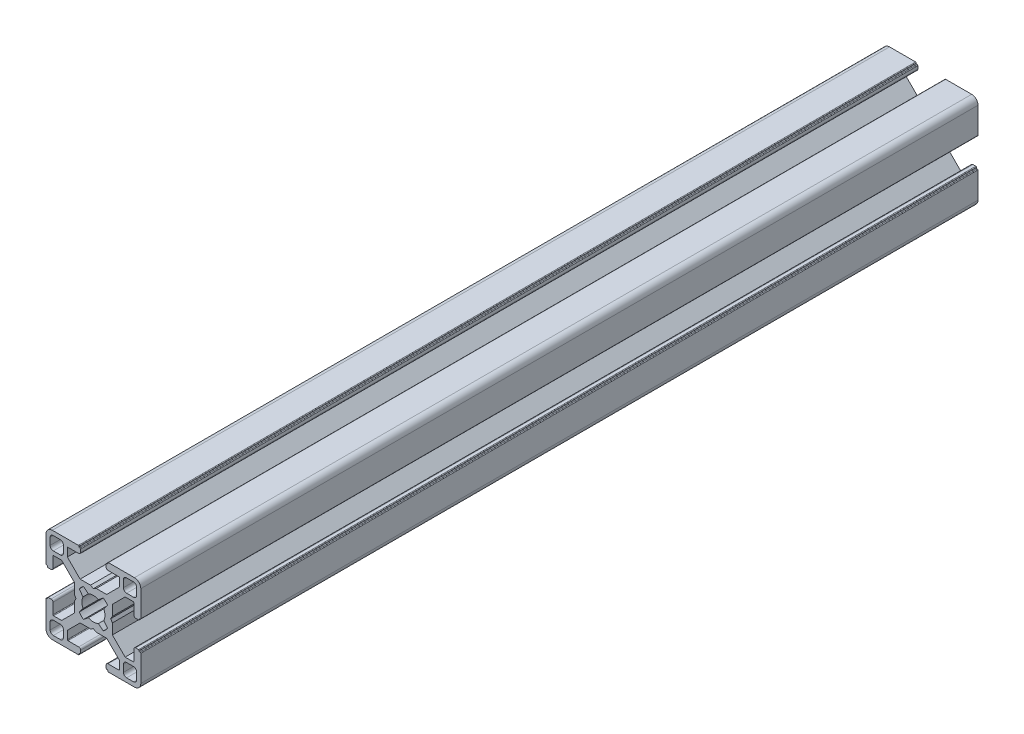
from build123d import *

# Parameters (mm, degrees)
BASE_EXTRUDE_DEPTH = 265


with BuildPart() as part:
    # Sketch1 → Base-Extrude (new body)
    with BuildSketch(Plane.XY):
        with BuildLine():
            Line((6.00446543, 0.899999619), (5.484852164, 0))
            Line((5.484852164, 0), (6.00446543, -0.899999619))
            Line((6.00446543, -0.899999619), (6.00446543, -4.204465866))
            Line((6.00446543, -4.204465866), (10.049999564, -8.25))
            Line((10.049999564, -8.25), (12.59999928, -8.25))
            ThreePointArc((12.59999928, -8.25), (12.741420837, -8.191421273), (12.799999564, -8.049999716))
            Line((12.799999564, -8.049999716), (12.799999564, -4.649999613))
            ThreePointArc((12.799999564, -4.649999613), (12.975735606, -4.225735278), (13.39999994, -4.049999237))
            Line((13.39999994, -4.049999237), (14.300000043, -4.049999237))
            ThreePointArc((14.300000043, -4.049999237), (14.4414216, -4.108577964), (14.500000327, -4.249999521))
            Line((14.500000327, -4.249999521), (14.500000327, -4.349998953))
            ThreePointArc((14.500000327, -4.349998953), (14.558579054, -4.49142051), (14.700000611, -4.549999237))
            Line((14.700000611, -4.549999237), (14.799999716, -4.549999237))
            ThreePointArc((14.799999716, -4.549999237), (14.941421273, -4.608577964), (15, -4.749999521))
            Line((15, -4.749999521), (15, -13.000000346))
            ThreePointArc((15, -13.000000346), (14.414213664, -14.414213664), (13.000000346, -15))
            Line((13.000000346, -15), (4.749999945, -15))
            ThreePointArc((4.749999945, -15), (4.60857832, -14.941421245), (4.549999564, -14.799999619))
            Line((4.549999564, -14.799999619), (4.549999564, -14.69999942))
            ThreePointArc((4.549999564, -14.69999942), (4.49142109, -14.558578474), (4.350000144, -14.5))
            Line((4.350000144, -14.5), (4.250000374, -14.5))
            ThreePointArc((4.250000374, -14.5), (4.108578753, -14.441421247), (4.05, -14.299999626))
            Line((4.05, -14.299999626), (4.05, -13.399999434))
            ThreePointArc((4.05, -13.399999434), (4.225735989, -12.975735226), (4.650000197, -12.799999237))
            Line((4.650000197, -12.799999237), (8.049999924, -12.799999237))
            ThreePointArc((8.049999924, -12.799999237), (8.191421565, -12.741420475), (8.250000327, -12.599998834))
            Line((8.250000327, -12.599998834), (8.250000327, -10.049999237))
            Line((8.250000327, -10.049999237), (4.204466193, -6))
            Line((4.204466193, -6), (0.899999946, -6))
            Line((0.899999946, -6), (0, -5.484851837))
            Line((0, -5.484851837), (-0.899999946, -6))
            Line((-0.899999946, -6), (-4.204466193, -6))
            Line((-4.204466193, -6), (-8.250000327, -10.049999237))
            Line((-8.250000327, -10.049999237), (-8.250000327, -12.599998834))
            ThreePointArc((-8.250000327, -12.599998834), (-8.191421565, -12.741420475), (-8.049999924, -12.799999237))
            Line((-8.049999924, -12.799999237), (-4.650000197, -12.799999237))
            ThreePointArc((-4.650000197, -12.799999237), (-4.225735989, -12.975735226), (-4.05, -13.399999434))
            Line((-4.05, -13.399999434), (-4.05, -14.299999626))
            ThreePointArc((-4.05, -14.299999626), (-4.108578753, -14.441421247), (-4.250000374, -14.5))
            Line((-4.250000374, -14.5), (-4.350000144, -14.5))
            ThreePointArc((-4.350000144, -14.5), (-4.49142109, -14.558578474), (-4.549999564, -14.69999942))
            Line((-4.549999564, -14.69999942), (-4.549999564, -14.799999619))
            ThreePointArc((-4.549999564, -14.799999619), (-4.60857832, -14.941421245), (-4.749999945, -15))
            Line((-4.749999945, -15), (-13.000000346, -15))
            ThreePointArc((-13.000000346, -15), (-14.414213664, -14.414213664), (-15, -13.000000346))
            Line((-15, -13.000000346), (-15, -4.749999521))
            ThreePointArc((-15, -4.749999521), (-14.941421273, -4.608577964), (-14.799999716, -4.549999237))
            Line((-14.799999716, -4.549999237), (-14.700000611, -4.549999237))
            ThreePointArc((-14.700000611, -4.549999237), (-14.558579054, -4.49142051), (-14.500000327, -4.349998953))
            Line((-14.500000327, -4.349998953), (-14.500000327, -4.249999521))
            ThreePointArc((-14.500000327, -4.249999521), (-14.4414216, -4.108577964), (-14.300000043, -4.049999237))
            Line((-14.300000043, -4.049999237), (-13.39999994, -4.049999237))
            ThreePointArc((-13.39999994, -4.049999237), (-12.975735606, -4.225735278), (-12.799999564, -4.649999613))
            Line((-12.799999564, -4.649999613), (-12.799999564, -8.049999716))
            ThreePointArc((-12.799999564, -8.049999716), (-12.741420837, -8.191421273), (-12.59999928, -8.25))
            Line((-12.59999928, -8.25), (-10.049999564, -8.25))
            Line((-10.049999564, -8.25), (-6.00446543, -4.204465866))
            Line((-6.00446543, -4.204465866), (-6.00446543, -0.899999619))
            Line((-6.00446543, -0.899999619), (-5.484852164, 0))
            Line((-5.484852164, 0), (-6.00446543, 0.899999619))
            Line((-6.00446543, 0.899999619), (-6.00446543, 4.204465866))
            Line((-6.00446543, 4.204465866), (-10.049999564, 8.25))
            Line((-10.049999564, 8.25), (-12.59999928, 8.25))
            ThreePointArc((-12.59999928, 8.25), (-12.741420837, 8.191421273), (-12.799999564, 8.049999716))
            Line((-12.799999564, 8.049999716), (-12.799999564, 4.649999613))
            ThreePointArc((-12.799999564, 4.649999613), (-12.975735606, 4.225735278), (-13.39999994, 4.049999237))
            Line((-13.39999994, 4.049999237), (-14.300000043, 4.049999237))
            ThreePointArc((-14.300000043, 4.049999237), (-14.4414216, 4.108577964), (-14.500000327, 4.249999521))
            Line((-14.500000327, 4.249999521), (-14.500000327, 4.349998953))
            ThreePointArc((-14.500000327, 4.349998953), (-14.558579054, 4.49142051), (-14.700000611, 4.549999237))
            Line((-14.700000611, 4.549999237), (-14.799999716, 4.549999237))
            ThreePointArc((-14.799999716, 4.549999237), (-14.941421273, 4.608577964), (-15, 4.749999521))
            Line((-15, 4.749999521), (-15, 13.000000346))
            ThreePointArc((-15, 13.000000346), (-14.414213664, 14.414213664), (-13.000000346, 15))
            Line((-13.000000346, 15), (-4.749999945, 15))
            ThreePointArc((-4.749999945, 15), (-4.60857832, 14.941421245), (-4.549999564, 14.799999619))
            Line((-4.549999564, 14.799999619), (-4.549999564, 14.69999942))
            ThreePointArc((-4.549999564, 14.69999942), (-4.49142109, 14.558578474), (-4.350000144, 14.5))
            Line((-4.350000144, 14.5), (-4.250000374, 14.5))
            ThreePointArc((-4.250000374, 14.5), (-4.108578753, 14.441421247), (-4.05, 14.299999626))
            Line((-4.05, 14.299999626), (-4.05, 13.399999434))
            ThreePointArc((-4.05, 13.399999434), (-4.225735989, 12.975735226), (-4.650000197, 12.799999237))
            Line((-4.650000197, 12.799999237), (-8.049999924, 12.799999237))
            ThreePointArc((-8.049999924, 12.799999237), (-8.191421565, 12.741420475), (-8.250000327, 12.599998834))
            Line((-8.250000327, 12.599998834), (-8.250000327, 10.049999237))
            Line((-8.250000327, 10.049999237), (-4.204466193, 6))
            Line((-4.204466193, 6), (-0.899999946, 6))
            Line((-0.899999946, 6), (0, 5.484851837))
            Line((0, 5.484851837), (0.899999946, 6))
            Line((0.899999946, 6), (4.204466193, 6))
            Line((4.204466193, 6), (8.250000327, 10.049999237))
            Line((8.250000327, 10.049999237), (8.250000327, 12.599998834))
            ThreePointArc((8.250000327, 12.599998834), (8.191421565, 12.741420475), (8.049999924, 12.799999237))
            Line((8.049999924, 12.799999237), (4.650000197, 12.799999237))
            ThreePointArc((4.650000197, 12.799999237), (4.225735989, 12.975735226), (4.05, 13.399999434))
            Line((4.05, 13.399999434), (4.05, 14.299999626))
            ThreePointArc((4.05, 14.299999626), (4.108578753, 14.441421247), (4.250000374, 14.5))
            Line((4.250000374, 14.5), (4.350000144, 14.5))
            ThreePointArc((4.350000144, 14.5), (4.49142109, 14.558578474), (4.549999564, 14.69999942))
            Line((4.549999564, 14.69999942), (4.549999564, 14.799999619))
            ThreePointArc((4.549999564, 14.799999619), (4.60857832, 14.941421245), (4.749999945, 15))
            Line((4.749999945, 15), (13.000000346, 15))
            ThreePointArc((13.000000346, 15), (14.414213664, 14.414213664), (15, 13.000000346))
            Line((15, 13.000000346), (15, 4.749999521))
            ThreePointArc((15, 4.749999521), (14.941421273, 4.608577964), (14.799999716, 4.549999237))
            Line((14.799999716, 4.549999237), (14.700000611, 4.549999237))
            ThreePointArc((14.700000611, 4.549999237), (14.558579054, 4.49142051), (14.500000327, 4.349998953))
            Line((14.500000327, 4.349998953), (14.500000327, 4.249999521))
            ThreePointArc((14.500000327, 4.249999521), (14.4414216, 4.108577964), (14.300000043, 4.049999237))
            Line((14.300000043, 4.049999237), (13.39999994, 4.049999237))
            ThreePointArc((13.39999994, 4.049999237), (12.975735606, 4.225735278), (12.799999564, 4.649999613))
            Line((12.799999564, 4.649999613), (12.799999564, 8.049999716))
            ThreePointArc((12.799999564, 8.049999716), (12.741420837, 8.191421273), (12.59999928, 8.25))
            Line((12.59999928, 8.25), (10.049999564, 8.25))
            Line((10.049999564, 8.25), (6.00446543, 4.204465866))
            Line((6.00446543, 4.204465866), (6.00446543, 0.899999619))
        make_face()
        with BuildLine():
            Line((13.70000109, 12.700000408), (13.70000109, 10.499999626))
            ThreePointArc((13.70000109, 10.499999626), (13.407107874, 9.792892851), (12.7000011, 9.499999635))
            Line((12.7000011, 9.499999635), (10.500000318, 9.499999635))
            ThreePointArc((10.500000318, 9.499999635), (9.792893543, 9.792892851), (9.500000327, 10.499999626))
            Line((9.500000327, 10.499999626), (9.500000327, 12.700000408))
            ThreePointArc((9.500000327, 12.700000408), (9.792893543, 13.407107182), (10.500000318, 13.700000398))
            Line((10.500000318, 13.700000398), (12.7000011, 13.700000398))
            ThreePointArc((12.7000011, 13.700000398), (13.407107874, 13.407107182), (13.70000109, 12.700000408))
        make_face(mode=Mode.SUBTRACT)
        with BuildLine():
            Line((3.135929412, 4.518400903), (1.600129524, 3.280561767))
            ThreePointArc((1.600129524, 3.280561767), (0, 3.65), (-1.600129524, 3.280561767))
            Line((-1.600129524, 3.280561767), (-3.135929412, 4.518400903))
            ThreePointArc((-3.135929412, 4.518400903), (-3.881002259, 3.897155561), (-4.505336892, 3.154669473))
            Line((-4.505336892, 3.154669473), (-3.280561732, 1.600129597))
            ThreePointArc((-3.280561732, 1.600129597), (-3.65, 0), (-3.280561732, -1.600129597))
            Line((-3.280561732, -1.600129597), (-4.505336892, -3.154669473))
            ThreePointArc((-4.505336892, -3.154669473), (-3.881002259, -3.897155561), (-3.135929412, -4.518400903))
            Line((-3.135929412, -4.518400903), (-1.600129524, -3.280561767))
            ThreePointArc((-1.600129524, -3.280561767), (0, -3.65), (1.600129524, -3.280561767))
            Line((1.600129524, -3.280561767), (3.135929412, -4.518400903))
            ThreePointArc((3.135929412, -4.518400903), (3.881002259, -3.897155561), (4.505336892, -3.154669473))
            Line((4.505336892, -3.154669473), (3.280561732, -1.600129597))
            ThreePointArc((3.280561732, -1.600129597), (3.65, 0), (3.280561732, 1.600129597))
            Line((3.280561732, 1.600129597), (4.505336892, 3.154669473))
            ThreePointArc((4.505336892, 3.154669473), (3.881002259, 3.897155561), (3.135929412, 4.518400903))
        make_face(mode=Mode.SUBTRACT)
        with BuildLine():
            Line((-13.70000109, -12.700000408), (-13.70000109, -10.499999626))
            ThreePointArc((-13.70000109, -10.499999626), (-13.407107874, -9.792892851), (-12.7000011, -9.499999635))
            Line((-12.7000011, -9.499999635), (-10.500000318, -9.499999635))
            ThreePointArc((-10.500000318, -9.499999635), (-9.792893543, -9.792892851), (-9.500000327, -10.499999626))
            Line((-9.500000327, -10.499999626), (-9.500000327, -12.700000408))
            ThreePointArc((-9.500000327, -12.700000408), (-9.792893543, -13.407107182), (-10.500000318, -13.700000398))
            Line((-10.500000318, -13.700000398), (-12.7000011, -13.700000398))
            ThreePointArc((-12.7000011, -13.700000398), (-13.407107874, -13.407107182), (-13.70000109, -12.700000408))
        make_face(mode=Mode.SUBTRACT)
        with BuildLine():
            Line((10.500000318, -13.700000398), (12.7000011, -13.700000398))
            ThreePointArc((12.7000011, -13.700000398), (13.407107874, -13.407107182), (13.70000109, -12.700000408))
            Line((13.70000109, -12.700000408), (13.70000109, -10.499999626))
            ThreePointArc((13.70000109, -10.499999626), (13.407107874, -9.792892851), (12.7000011, -9.499999635))
            Line((12.7000011, -9.499999635), (10.500000318, -9.499999635))
            ThreePointArc((10.500000318, -9.499999635), (9.792893543, -9.792892851), (9.500000327, -10.499999626))
            Line((9.500000327, -10.499999626), (9.500000327, -12.700000408))
            ThreePointArc((9.500000327, -12.700000408), (9.792893543, -13.407107182), (10.500000318, -13.700000398))
        make_face(mode=Mode.SUBTRACT)
        with BuildLine():
            Line((-10.500000318, 13.700000398), (-12.7000011, 13.700000398))
            ThreePointArc((-12.7000011, 13.700000398), (-13.407107874, 13.407107182), (-13.70000109, 12.700000408))
            Line((-13.70000109, 12.700000408), (-13.70000109, 10.499999626))
            ThreePointArc((-13.70000109, 10.499999626), (-13.407107874, 9.792892851), (-12.7000011, 9.499999635))
            Line((-12.7000011, 9.499999635), (-10.500000318, 9.499999635))
            ThreePointArc((-10.500000318, 9.499999635), (-9.792893543, 9.792892851), (-9.500000327, 10.499999626))
            Line((-9.500000327, 10.499999626), (-9.500000327, 12.700000408))
            ThreePointArc((-9.500000327, 12.700000408), (-9.792893543, 13.407107182), (-10.500000318, 13.700000398))
        make_face(mode=Mode.SUBTRACT)
    extrude(amount=-BASE_EXTRUDE_DEPTH)


solid = part.part
